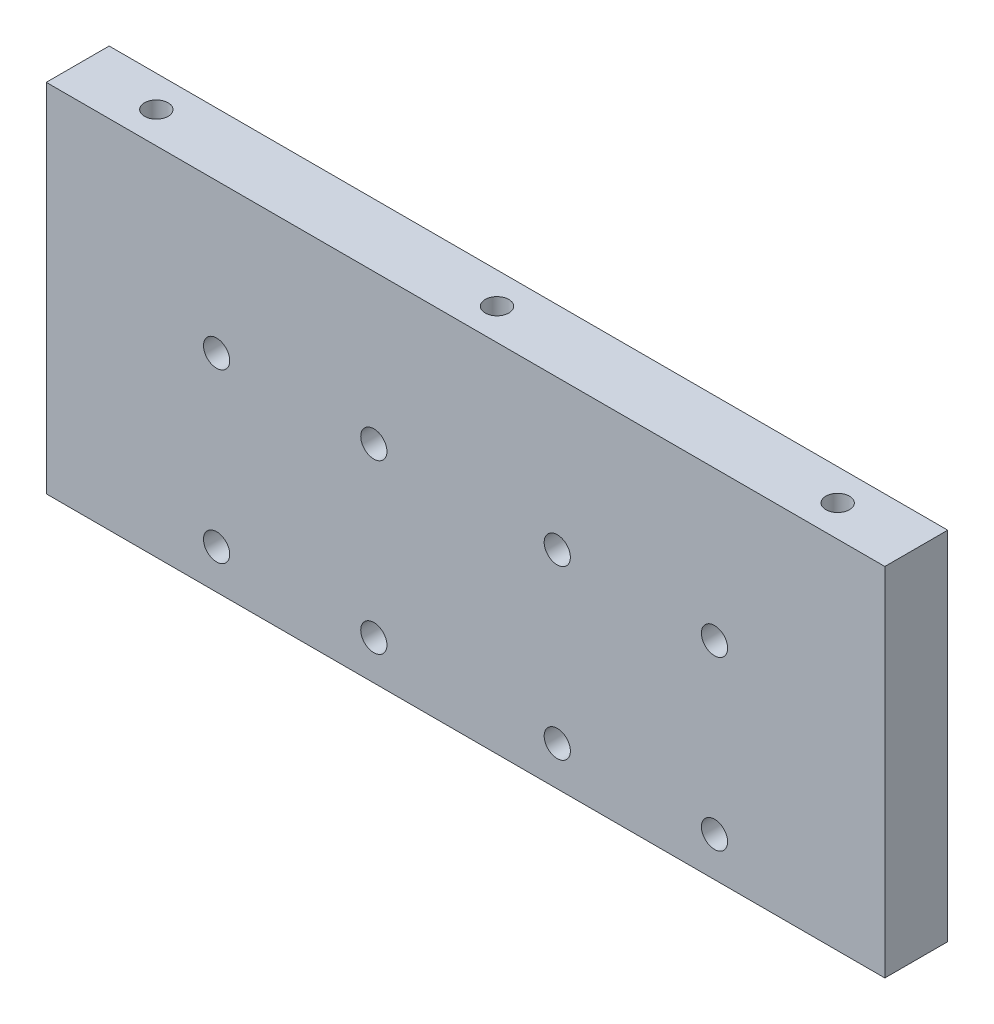
from build123d import *

# Parameters (mm, degrees)
ESQUISSE1_W             = 160
ESQUISSE1_H             = 68
ESQUISSE1_R             = 2.5
BOSS_EXTRU_1_DEPTH      = 12
ESQUISSE2_R             = 2.25
ENL_V_MAT_EXTRU_1_DEPTH = 15
ESQUISSE3_R             = 4.5
ENL_V_MAT_EXTRU_2_DEPTH = 5


with BuildPart() as part:
    # Esquisse1 → Boss.-Extru.1 (new body)
    with BuildSketch(Plane.XY):
        with Locations((80, 34)):
            Rectangle(ESQUISSE1_W, ESQUISSE1_H)
        with Locations((62.5, 39.5)):
            Circle(ESQUISSE1_R, mode=Mode.SUBTRACT)
        with Locations((32.5, 39.5)):
            Circle(ESQUISSE1_R, mode=Mode.SUBTRACT)
        with Locations((32.5, 7.5)):
            Circle(ESQUISSE1_R, mode=Mode.SUBTRACT)
        with Locations((62.5, 7.5)):
            Circle(ESQUISSE1_R, mode=Mode.SUBTRACT)
        with Locations(Location((97.5, 7.5, 0), (0, 0, 180))):
            Circle(ESQUISSE1_R, mode=Mode.SUBTRACT)
        with Locations(Location((127.5, 7.5, 0), (0, 0, 180))):
            Circle(ESQUISSE1_R, mode=Mode.SUBTRACT)
        with Locations(Location((127.5, 39.5, 0), (0, 0, 180))):
            Circle(ESQUISSE1_R, mode=Mode.SUBTRACT)
        with Locations(Location((97.5, 39.5, 0), (0, 0, 180))):
            Circle(ESQUISSE1_R, mode=Mode.SUBTRACT)
    extrude(amount=BOSS_EXTRU_1_DEPTH)

    # Esquisse2 → Enlèv. mat.-Extru.1 (cut)
    with BuildSketch(Plane(origin=(0, 68, 0), x_dir=(1, 0, 0), z_dir=(0, 1, 0))):
        with Locations(Location((15, -6, 0), (0, 0, 270))):
            Circle(ESQUISSE2_R)
        with Locations(Location((80, -6, 0), (0, 0, 270))):
            Circle(ESQUISSE2_R)
        with Locations(Location((145, -6, 0), (0, 0, 270))):
            Circle(ESQUISSE2_R)
    extrude(amount=-ENL_V_MAT_EXTRU_1_DEPTH, mode=Mode.SUBTRACT)

    # Esquisse3 → Enlèv. mat.-Extru.2 (cut)
    with BuildSketch(Plane(origin=(0, 0, 0), x_dir=(-1, 0, 0), z_dir=(0, 0, -1))):
        with Locations((-127.5, 39.5)):
            Circle(ESQUISSE3_R)
        with Locations((-127.5, 7.5)):
            Circle(ESQUISSE3_R)
        with Locations((-97.5, 39.5)):
            Circle(ESQUISSE3_R)
        with Locations((-62.5, 39.5)):
            Circle(ESQUISSE3_R)
        with Locations((-97.5, 7.5)):
            Circle(ESQUISSE3_R)
        with Locations((-62.5, 7.5)):
            Circle(ESQUISSE3_R)
        with Locations((-32.5, 7.5)):
            Circle(ESQUISSE3_R)
        with Locations((-32.5, 39.5)):
            Circle(ESQUISSE3_R)
    extrude(amount=-ENL_V_MAT_EXTRU_2_DEPTH, mode=Mode.SUBTRACT)


solid = part.part
